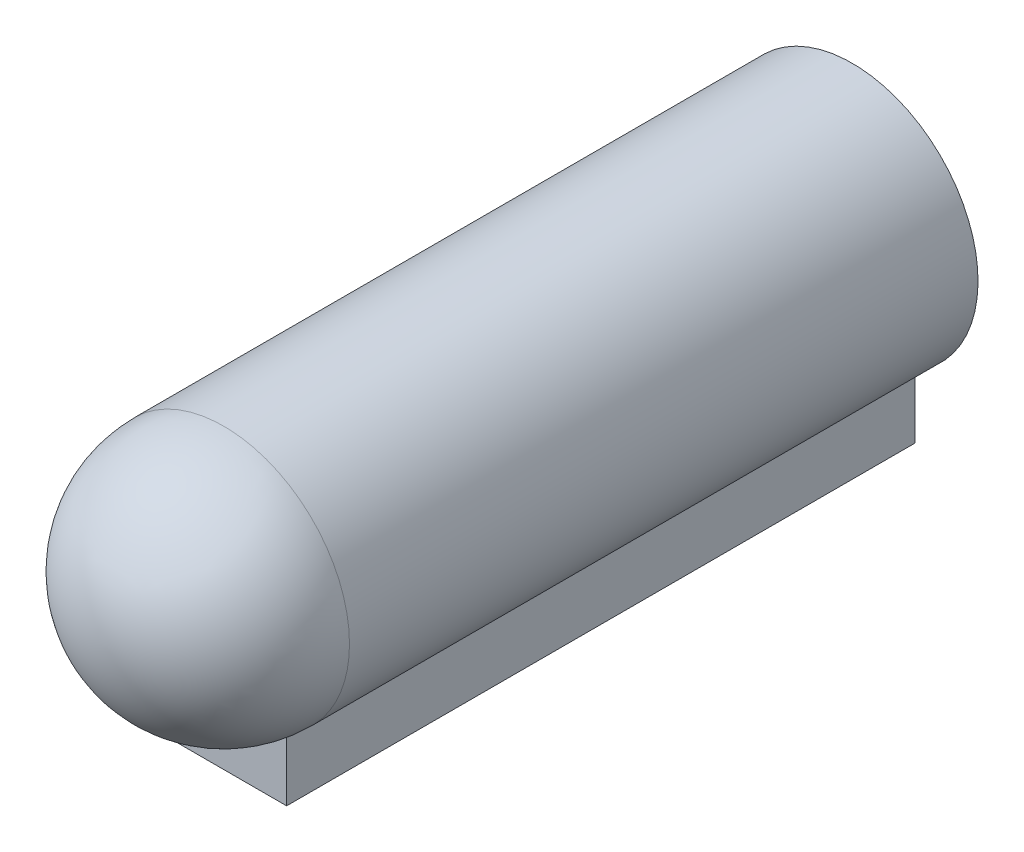
from build123d import *

# Parameters (mm, degrees)
SZKIC1_R                    = 5
DODANIE_WYCI_GNI_CIE1_DEPTH = 30
SZKIC1_3_R                  = 3
WYTNIJ_WYCI_GNI_CIE1_DEPTH  = 20
ZAOKR_GLENIE1_R             = 5
DODANIE_WYCI_GNI_CIE2_DEPTH = 25


with BuildPart() as part:
    # Szkic1 → Dodanie-wyciągnięcie1 (new body)
    with BuildSketch(Plane.XY):
        Circle(SZKIC1_R)
    extrude(amount=DODANIE_WYCI_GNI_CIE1_DEPTH)

    # Szkic1<3> → Wytnij-wyciągnięcie1 (cut)
    with BuildSketch(Plane.XY):
        Circle(SZKIC1_3_R)
    extrude(amount=WYTNIJ_WYCI_GNI_CIE1_DEPTH, mode=Mode.SUBTRACT)

    # Zaokrąglenie1
    zaokr_glenie1_edges = [part.edges().sort_by_distance(p)[0] for p in [
        (-5, 0, 30),
    ]]
    fillet(zaokr_glenie1_edges, radius=ZAOKR_GLENIE1_R)

    # Szkic4 → Dodanie-wyciągnięcie2 (add)
    with BuildSketch(Plane(origin=(0, 0, 0), x_dir=(-1, 0, 0), z_dir=(0, 0, -1))):
        with BuildLine():
            ThreePointArc((2.5, -4.330127019), (0, -5), (-2.5, -4.330127019))
            Line((-2.5, -4.330127019), (-2.5, -6.830127019))
            Line((-2.5, -6.830127019), (2.5, -6.830127019))
            Line((2.5, -6.830127019), (2.5, -4.330127019))
        make_face()
    extrude(amount=-DODANIE_WYCI_GNI_CIE2_DEPTH)


solid = part.part
